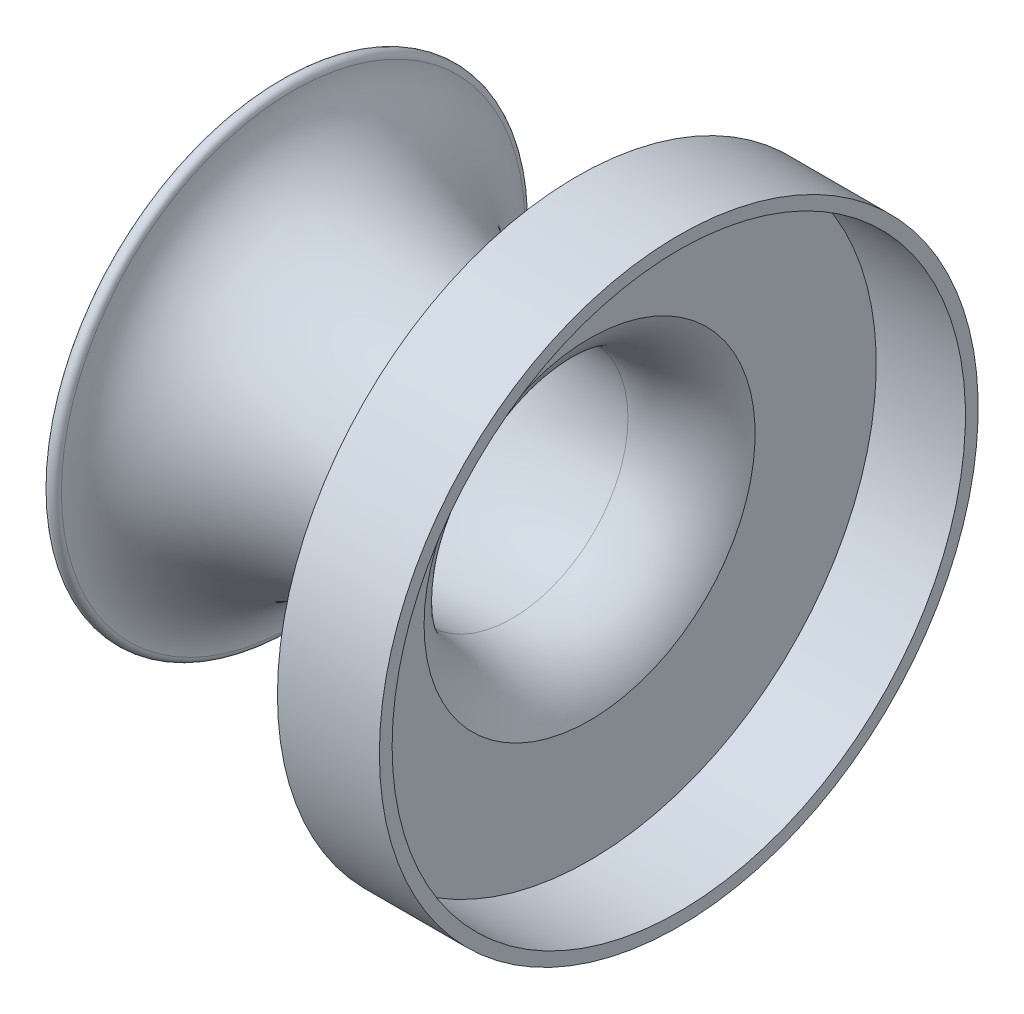
from build123d import *


with BuildPart() as part:
    # Sketch1 → Revolve1 (revolve)
    with BuildSketch(Plane.XY, mode=Mode.PRIVATE) as revolve1_sk:
        with BuildLine():
            Line((15.446351252, 33.000061), (15.446351252, 57.15))
            Line((15.446351252, 57.15), (33.226351252, 57.15))
            Line((33.226351252, 57.15), (33.226351252, 59.69))
            Line((33.226351252, 59.69), (12.906351252, 59.69))
            Line((12.906351252, 59.69), (12.906351252, 33.579511809))
            ThreePointArc((12.906351252, 33.579511809), (7.576431779, 27.783815658), (0, 25.64003))
            add(Edge.make_bspline(
                [(-43.66006, 46.20006), (-43.66006, 45.606103818), (-43.544794528, 44.432570076), (-42.839776678, 42.039054169), (-41.001665327, 38.971251765), (-37.14971819, 35.345133748), (-31.752396376, 32.048371643), (-25.035415413, 29.287682921), (-17.281065772, 27.214070609), (-8.82958884, 25.929831174), (-2.92413983, 25.64003), (0, 25.64003)],
                knots=[3.141592654, 3.141592654, 3.141592654, 3.141592654, 3.239767424, 3.337942194, 3.534291735, 3.730641276, 3.926990817, 4.123340358, 4.319689899, 4.51603944, 4.71238898, 4.71238898, 4.71238898, 4.71238898], degree=3))
            ThreePointArc((-43.66006, 46.20006), (-44.93006, 47.47006), (-46.20006, 46.20006))
            add(Edge.make_bspline(
                [(-46.20006, 46.20006), (-46.20006, 23.10003), (0, 23.10003)],
                knots=[3.141592654, 3.141592654, 3.141592654, 4.71238898, 4.71238898, 4.71238898], degree=2, weights=[1, 0.707106781, 1]))
            ThreePointArc((0, 23.10003), (9.1733361, 25.787457832), (15.446351252, 33.000061))
        make_face()
    revolve(revolve1_sk.sketch.rotate(Axis((0, 0, 0), (1, 0, 0)), 90), axis=Axis((0, 0, 0), (1, 0, 0)))


solid = part.part
